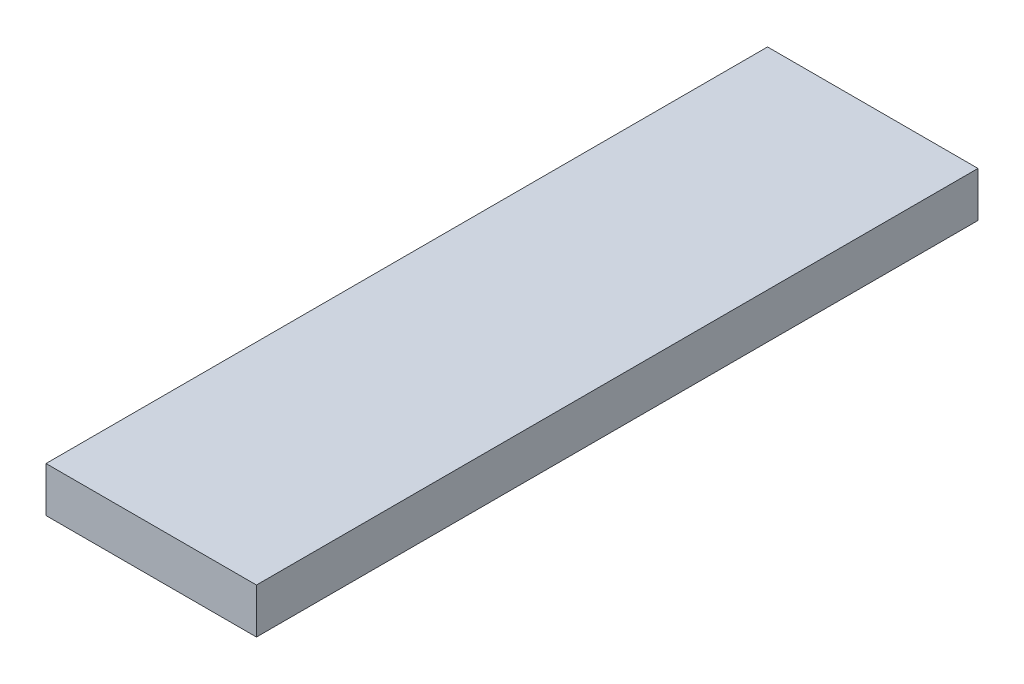
from build123d import *

# Parameters (mm, degrees)
SKETCH2_W           = 88.9
SKETCH2_H           = 19.05
BOSS_EXTRUDE1_DEPTH = 152.4


with BuildPart() as part:
    # Sketch2 → Boss-Extrude1 (new, symmetric)
    with BuildSketch(Plane.XY):
        Rectangle(SKETCH2_W, SKETCH2_H)
    extrude(amount=BOSS_EXTRUDE1_DEPTH, both=True)


solid = part.part
